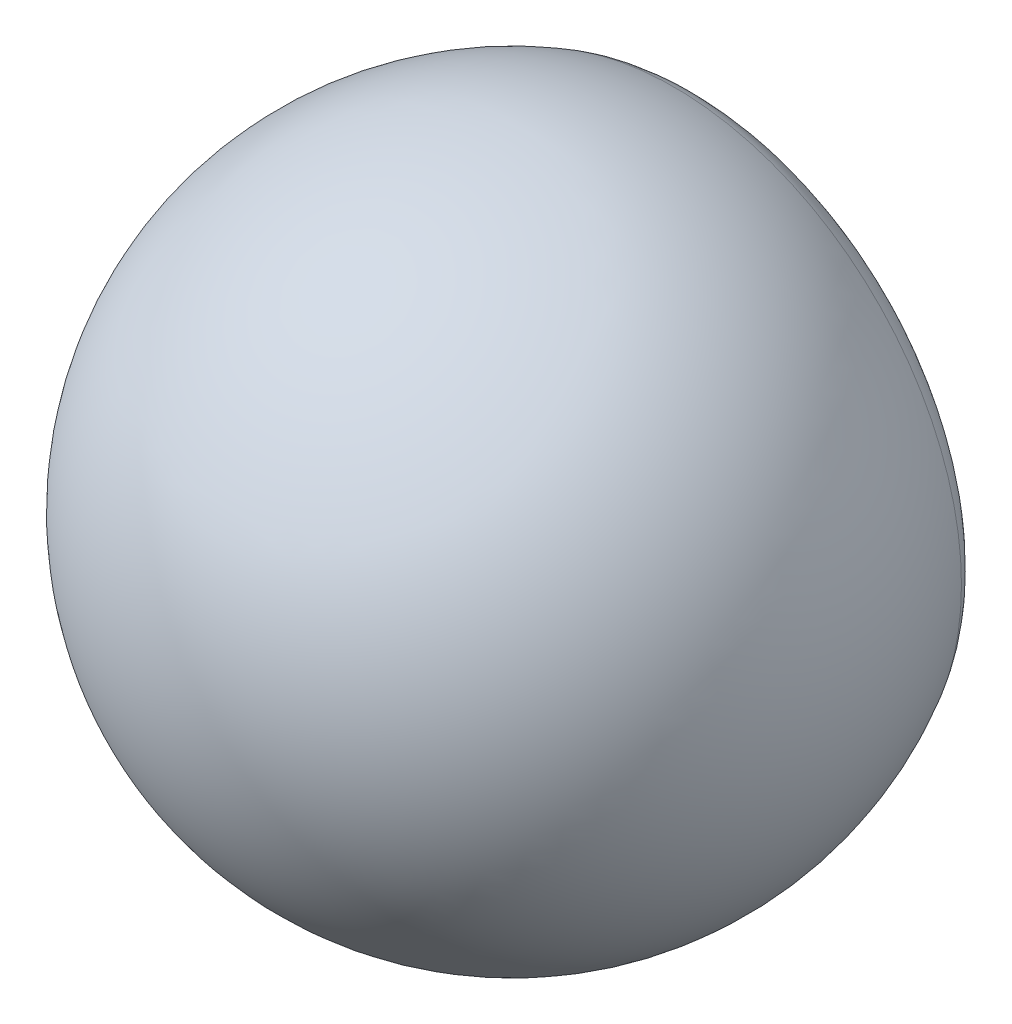
from build123d import *


with BuildPart() as part:
    # 草图2 → 旋转1 (revolve)
    with BuildSketch(Plane(origin=(0, 0, 0), x_dir=(1, 0, 0), z_dir=(0, 1, 0))):
        with BuildLine():
            Line((0, -90.962021837), (0, -102.56687077))
            ThreePointArc((0, -102.56687077), (9.051295697, -97.376413347), (9.143034238, -86.942891119))
            ThreePointArc((9.143034238, -86.942891119), (6.847819602, -85.756520463), (4.849639886, -87.394434802))
            ThreePointArc((4.849639886, -87.394434802), (3.010260964, -89.974054208), (0, -90.962021837))
        make_face()
    revolve(axis=Axis((0, 0, 0), (0, 0, -1)))


solid = part.part
